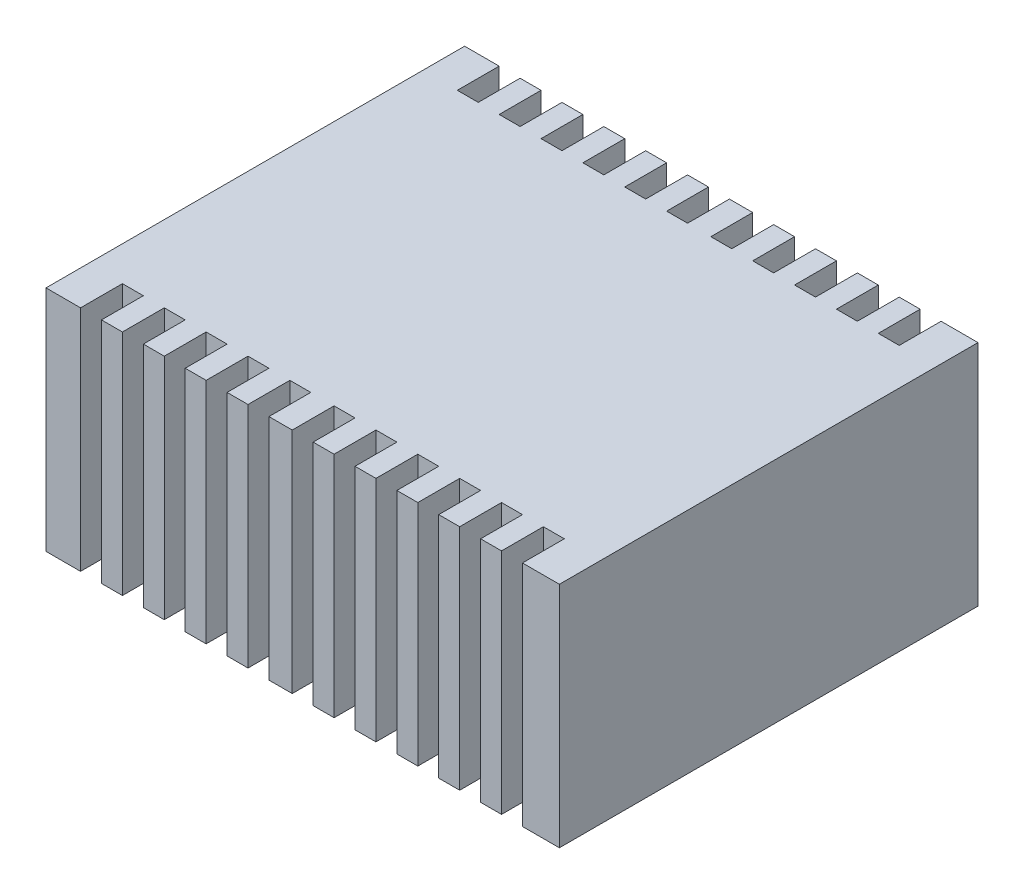
from build123d import *

# Parameters (mm, degrees)
BOSS_EXTRUDE1_DEPTH = 1000
CUT_EXTRUDE1_DEPTH  = 100
CUT_EXTRUDE2_DEPTH  = 100


with BuildPart() as part:
    # Sketch1 → Boss-Extrude1 (new body)
    with BuildSketch(Plane.XY):
        Polygon((390.286155145, -454.00220839), (340.286155145, -454.00220839), (340.286155145, -504.00220839), (290.286155145, -504.00220839), (290.286155145, -454.00220839), (240.286155145, -454.00220839), (240.286155145, -504.00220839), (184.64446635, -504.00220839), (184.64446635, -454.00220839), (134.64446635, -454.00220839), (134.64446635, -504.00220839), (84.64446635, -504.00220839), (84.64446635, -454.00220839), (34.64446635, -454.00220839), (34.64446635, -504.00220839), (-15.35553365, -504.00220839), (-15.35553365, -454.00220839), (-65.35553365, -454.00220839), (-65.35553365, -504.00220839), (-115.35553365, -504.00220839), (-115.35553365, -454.00220839), (-165.35553365, -454.00220839), (-165.35553365, -504.00220839), (-215.35553365, -504.00220839), (-215.35553365, -454.00220839), (-265.35553365, -454.00220839), (-265.35553365, -504.00220839), (-347.890991568, -504.00220839), (-347.890991568, 41.240606266), (878.463301858, 41.240606266), (878.463301858, -504.00220839), (790.286155145, -504.00220839), (790.286155145, -454.00220839), (740.286155145, -454.00220839), (740.286155145, -504.00220839), (690.286155145, -504.00220839), (690.286155145, -454.00220839), (640.286155145, -454.00220839), (640.286155145, -504.00220839), (590.286155145, -504.00220839), (590.286155145, -454.00220839), (540.286155145, -454.00220839), (540.286155145, -504.00220839), (490.286155145, -504.00220839), (490.286155145, -454.00220839), (440.286155145, -454.00220839), (440.286155145, -504.00220839), (390.286155145, -504.00220839), align=None)
    extrude(amount=BOSS_EXTRUDE1_DEPTH)

    # Sketch2 → Cut-Extrude1 (cut)
    with BuildSketch(Plane.XY.offset(1000)):
        Polygon((-265.35553365, -454.00220839), (-265.35553365, 201.707253547), (-265.35553365, 367.434180801), (790.286155145, 367.434180801), (790.286155145, -454.00220839), (740.286155145, -454.00220839), (740.286155145, 201.707253547), (690.286155145, 201.707253547), (690.286155145, -454.00220839), (640.286155145, -454.00220839), (640.286155145, 201.707253547), (590.286155145, 201.707253547), (590.286155145, -454.00220839), (540.286155145, -454.00220839), (540.286155145, 201.707253547), (490.286155145, 201.707253547), (490.286155145, -454.00220839), (440.286155145, -454.00220839), (440.286155145, 201.707253547), (390.286155145, 201.707253547), (390.286155145, -454.00220839), (340.286155145, -454.00220839), (340.286155145, 201.707253547), (290.286155145, 201.707253547), (290.286155145, -454.00220839), (240.286155145, -454.00220839), (240.286155145, 201.707253547), (184.64446635, 201.707253547), (184.64446635, -454.00220839), (134.64446635, -454.00220839), (134.64446635, 201.707253547), (84.64446635, 201.707253547), (84.64446635, -454.00220839), (34.64446635, -454.00220839), (34.64446635, 201.707253547), (-15.35553365, 201.707253547), (-15.35553365, -454.00220839), (-65.35553365, -454.00220839), (-65.35553365, 201.707253547), (-115.35553365, 201.707253547), (-115.35553365, -454.00220839), (-165.35553365, -454.00220839), (-165.35553365, 201.707253547), (-215.35553365, 201.707253547), (-215.35553365, -454.00220839), align=None)
    extrude(amount=-CUT_EXTRUDE1_DEPTH, mode=Mode.SUBTRACT)

    # Sketch3 → Cut-Extrude2 (cut)
    with BuildSketch(Plane(origin=(0, 0, 0), x_dir=(-1, 0, 0), z_dir=(0, 0, -1))):
        Polygon((-790.286155145, -454.00220839), (-790.286155145, 201.707253547), (-790.286155145, 367.434180801), (265.35553365, 367.434180801), (265.35553365, -454.00220839), (215.35553365, -454.00220839), (215.35553365, 201.707253547), (165.35553365, 201.707253547), (165.35553365, -454.00220839), (115.35553365, -454.00220839), (115.35553365, 201.707253547), (65.35553365, 201.707253547), (65.35553365, -454.00220839), (15.35553365, -454.00220839), (15.35553365, 201.707253547), (-34.64446635, 201.707253547), (-34.64446635, -454.00220839), (-84.64446635, -454.00220839), (-84.64446635, 201.707253547), (-134.64446635, 201.707253547), (-134.64446635, -454.00220839), (-184.64446635, -454.00220839), (-184.64446635, 201.707253547), (-234.64446635, 201.707253547), (-234.64446635, -454.00220839), (-284.64446635, -454.00220839), (-284.64446635, 201.707253547), (-340.286155145, 201.707253547), (-340.286155145, -454.00220839), (-390.286155145, -454.00220839), (-390.286155145, 201.707253547), (-440.286155145, 201.707253547), (-440.286155145, -454.00220839), (-490.286155145, -454.00220839), (-490.286155145, 201.707253547), (-540.286155145, 201.707253547), (-540.286155145, -454.00220839), (-590.286155145, -454.00220839), (-590.286155145, 201.707253547), (-640.286155145, 201.707253547), (-640.286155145, -454.00220839), (-690.286155145, -454.00220839), (-690.286155145, 201.707253547), (-740.286155145, 201.707253547), (-740.286155145, -454.00220839), align=None)
    extrude(amount=-CUT_EXTRUDE2_DEPTH, mode=Mode.SUBTRACT)


solid = part.part
